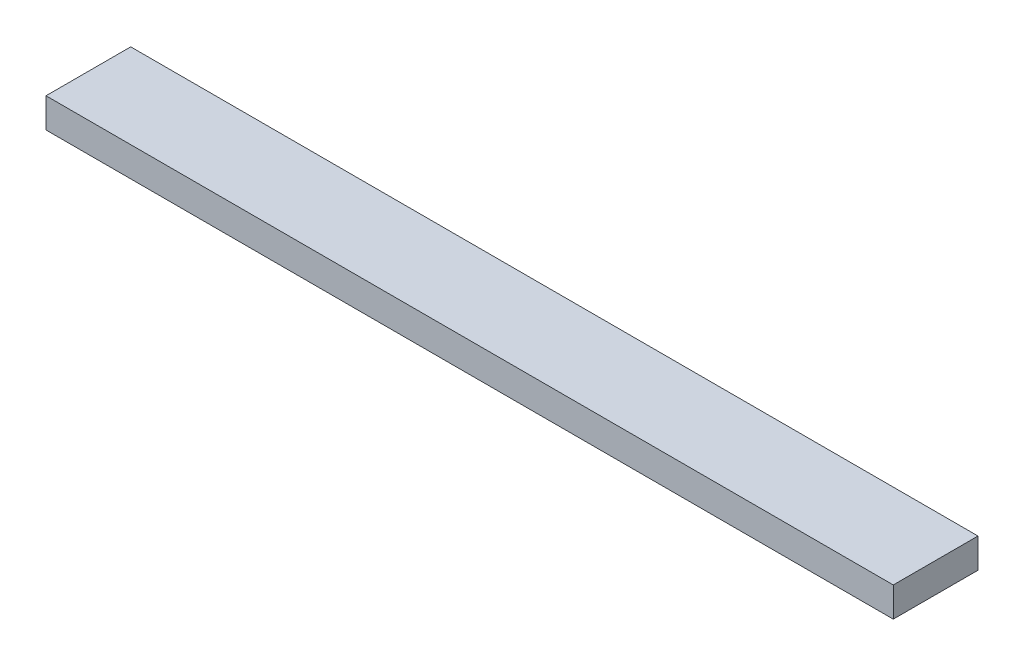
from build123d import *

# Parameters (mm, degrees)
SKETCH1_W           = 20
SKETCH1_H           = 2
BOSS_EXTRUDE1_DEPTH = 0.7


with BuildPart() as part:
    # Sketch1 → Boss-Extrude1 (new body)
    with BuildSketch(Plane(origin=(0, 0, 0), x_dir=(1, 0, 0), z_dir=(0, 1, 0))):
        Rectangle(SKETCH1_W, SKETCH1_H)
    extrude(amount=BOSS_EXTRUDE1_DEPTH)


solid = part.part
